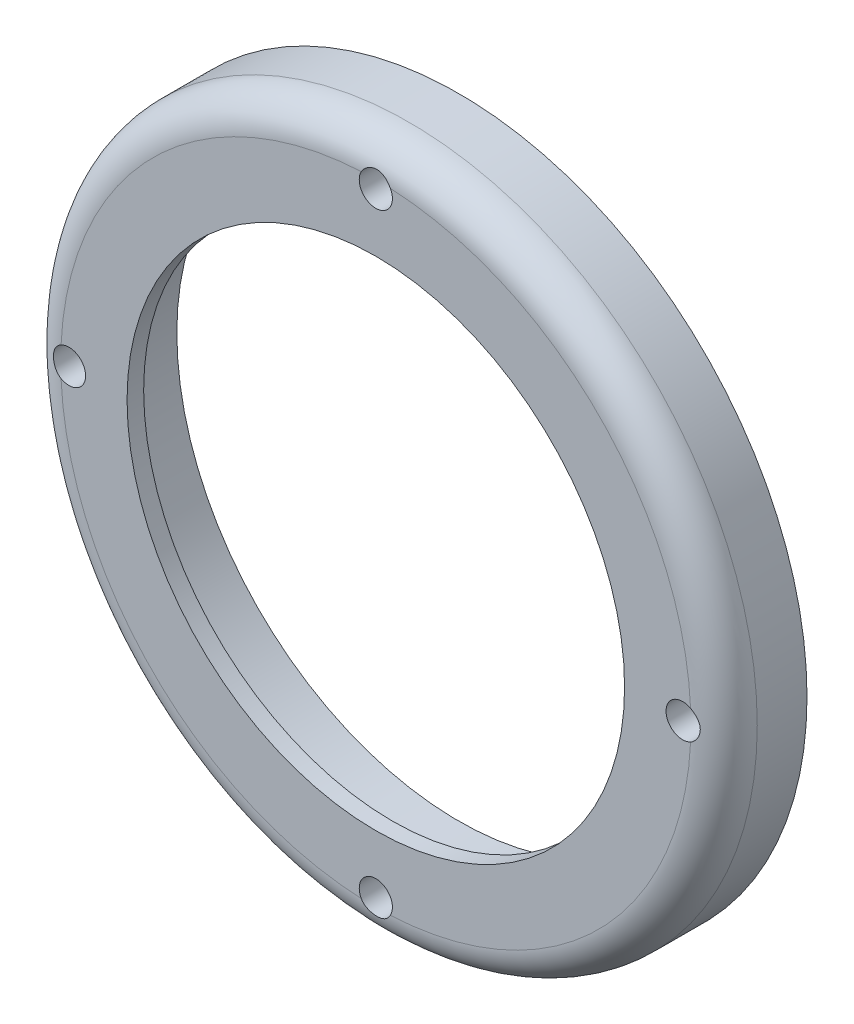
from build123d import *

# Parameters (mm, degrees)
SKETCH1_R           = 52.5
BOSS_EXTRUDE1_DEPTH = 20
SKETCH2_R           = 42.5
SKETCH2_R_2         = 40
CUT_EXTRUDE1_DEPTH  = 10
SKETCH4_R           = 40
CUT_EXTRUDE3_DEPTH  = 10
SKETCH8_R           = 55
CUT_EXTRUDE4_DEPTH  = 7.5
SKETCH9_R           = 37.5
CUT_EXTRUDE5_DEPTH  = 2.5
FILLET1_R           = 5
SKETCH10_R          = 2.5
CUT_EXTRUDE6_DEPTH  = 5
SKETCH11_R          = 1.5
CUT_EXTRUDE7_DEPTH  = 7.5
SKETCH13_R          = 1.5
CUT_EXTRUDE9_DEPTH  = 7.5
SKETCH14_R          = 1.5
CUT_EXTRUDE10_DEPTH = 7.5
SKETCH15_R          = 1.5
CUT_EXTRUDE11_DEPTH = 7.5


with BuildPart() as part:
    # Sketch1 → Boss-Extrude1 (new body)
    with BuildSketch(Plane.XY):
        Circle(SKETCH1_R)
    extrude(amount=BOSS_EXTRUDE1_DEPTH)

    # Sketch2 → Cut-Extrude1 (cut)
    with BuildSketch(Plane(origin=(0, 0, 0), x_dir=(-1, 0, 0), z_dir=(0, 0, -1))):
        Circle(SKETCH2_R)
        Circle(SKETCH2_R_2, mode=Mode.SUBTRACT)
    extrude(amount=-CUT_EXTRUDE1_DEPTH, mode=Mode.SUBTRACT)

    # Sketch4 → Cut-Extrude3 (cut)
    with BuildSketch(Plane(origin=(0, 0, 0), x_dir=(-1, 0, 0), z_dir=(0, 0, -1))):
        Circle(SKETCH4_R)
    extrude(amount=-CUT_EXTRUDE3_DEPTH, mode=Mode.SUBTRACT)

    # Sketch8 → Cut-Extrude4 (cut)
    with BuildSketch(Plane.XY.offset(20)):
        Circle(SKETCH8_R)
    extrude(amount=-CUT_EXTRUDE4_DEPTH, mode=Mode.SUBTRACT)

    # Sketch9 → Cut-Extrude5 (cut)
    with BuildSketch(Plane(origin=(0, 0, 10), x_dir=(-1, 0, 0), z_dir=(0, 0, -1))):
        Circle(SKETCH9_R)
    extrude(amount=-CUT_EXTRUDE5_DEPTH, mode=Mode.SUBTRACT)

    # Fillet1
    fillet1_edges = [part.edges().sort_by_distance(p)[0] for p in [
        (-52.5, 0, 12.5),
    ]]
    fillet(fillet1_edges, radius=FILLET1_R)

    # Sketch10 → Cut-Extrude6 (cut)
    with BuildSketch(Plane.XY.offset(12.5)):
        with Locations((0, 46.25)):
            Circle(SKETCH10_R)
        with Locations((46.25, 0)):
            Circle(SKETCH10_R)
        with Locations((0, -46.25)):
            Circle(SKETCH10_R)
        with Locations((-46.25, 0)):
            Circle(SKETCH10_R)
    extrude(amount=-CUT_EXTRUDE6_DEPTH, mode=Mode.SUBTRACT)

    # Sketch11 → Cut-Extrude7 (cut)
    with BuildSketch(Plane.XY.offset(7.5)):
        with Locations((0, 46.25)):
            Circle(SKETCH11_R)
    extrude(amount=-CUT_EXTRUDE7_DEPTH, mode=Mode.SUBTRACT)

    # Sketch13 → Cut-Extrude9 (cut)
    with BuildSketch(Plane.XY.offset(7.5)):
        with Locations((0, -46.25)):
            Circle(SKETCH13_R)
    extrude(amount=-CUT_EXTRUDE9_DEPTH, mode=Mode.SUBTRACT)

    # Sketch14 → Cut-Extrude10 (cut)
    with BuildSketch(Plane.XY.offset(7.5)):
        with Locations((-46.25, 0)):
            Circle(SKETCH14_R)
    extrude(amount=-CUT_EXTRUDE10_DEPTH, mode=Mode.SUBTRACT)

    # Sketch15 → Cut-Extrude11 (cut)
    with BuildSketch(Plane.XY.offset(7.5)):
        with Locations((46.25, 0)):
            Circle(SKETCH15_R)
    extrude(amount=-CUT_EXTRUDE11_DEPTH, mode=Mode.SUBTRACT)


solid = part.part
